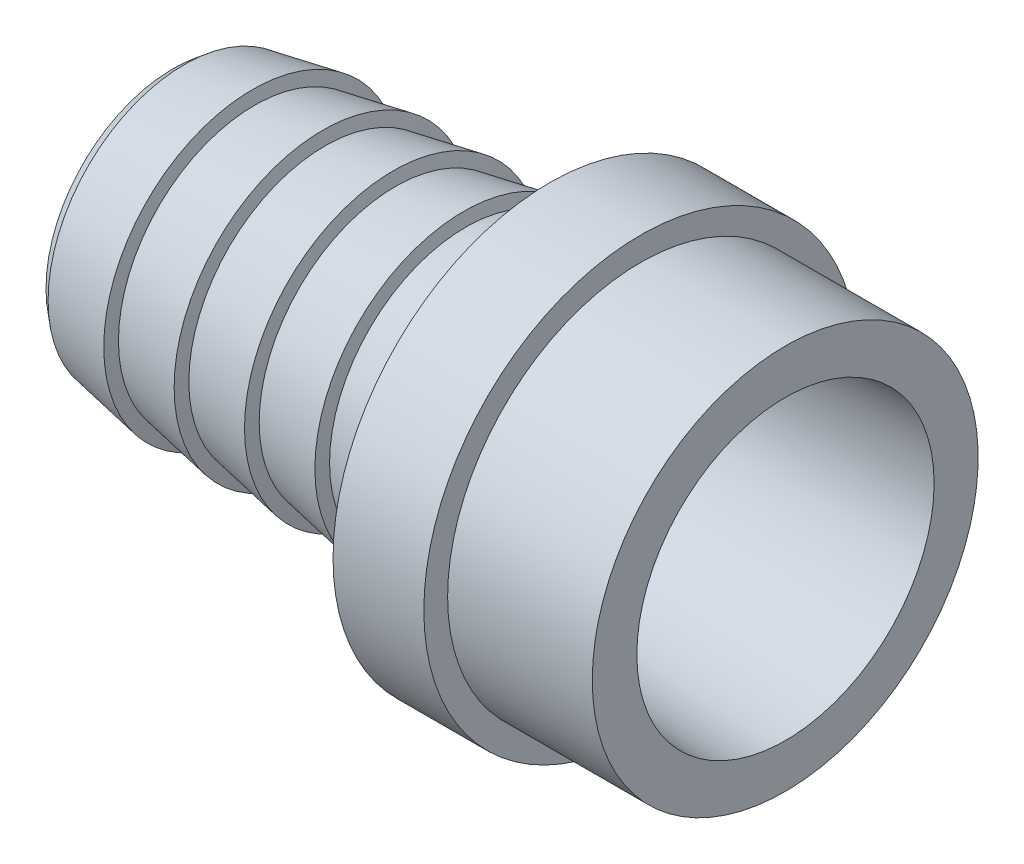
from build123d import *


with BuildPart() as part:
    # Sketch1 → Revolve2 (revolve)
    with BuildSketch(Plane(origin=(0, 0, 0), x_dir=(1, 0, 0), z_dir=(0, 1, 0)), mode=Mode.PRIVATE) as revolve2_sk:
        Polygon((0, 10.095412493), (0, 11.183615724), (1, 12), (7, 13.095445115), (7.2, 12), (13.2, 13.095445115), (13.4, 12), (19.4, 13.095445115), (19.6, 12), (25.6, 13.095445115), (25.8, 12), (31.8, 13.095445115), (33.2, 13.095445115), (33.2, 19.095445115), (41.2, 19.095445115), (41.2, 17), (53.943818363, 17), (53.967510613, 13.095445115), align=None)
    revolve(revolve2_sk.sketch.rotate(Axis((0, 0, 0), (1, 0, 0)), 180), axis=Axis((0, 0, 0), (1, 0, 0)))


solid = part.part
